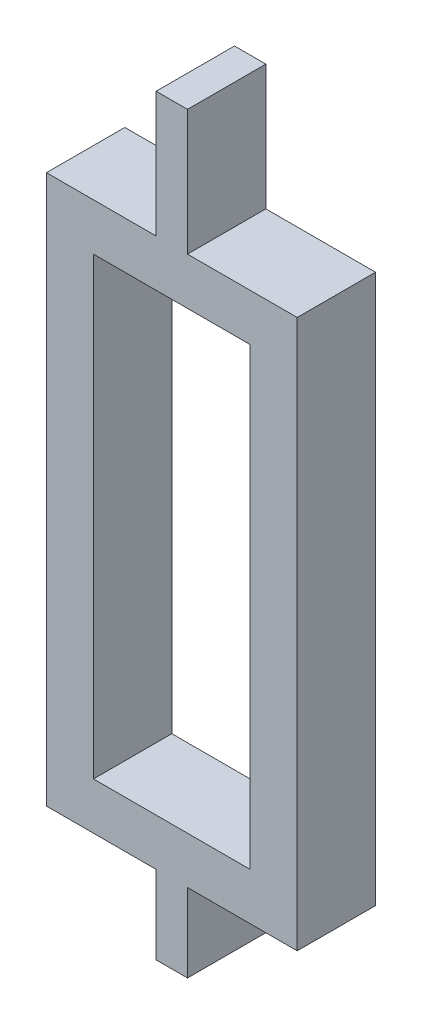
from build123d import *

# Parameters (mm, degrees)
BOSS_EXTRUDE1_DEPTH = 6.35
SKETCH3_W           = 12.7
SKETCH3_H           = 36.83
CUT_EXTRUDE1_DEPTH  = 6.35


with BuildPart() as part:
    # Sketch1 → Boss-Extrude1 (new body)
    with BuildSketch(Plane.XY):
        Polygon((10.16, 0.022003094), (10.16, 44.472003094), (1.27, 44.472003094), (1.27, 54.632003094), (-1.27, 54.632003094), (-1.27, 44.472003094), (-10.16, 44.472003094), (-10.16, 0.022003094), (-1.27, 0.022003094), (-1.27, -6.327996906), (1.27, -6.327996906), (1.27, 0.022003094), align=None)
    extrude(amount=BOSS_EXTRUDE1_DEPTH)

    # Sketch3 → Cut-Extrude1 (cut)
    with BuildSketch(Plane.XY.offset(6.35)):
        with Locations((0, 22.247003094)):
            Rectangle(SKETCH3_W, SKETCH3_H)
    extrude(amount=-CUT_EXTRUDE1_DEPTH, mode=Mode.SUBTRACT)


solid = part.part
